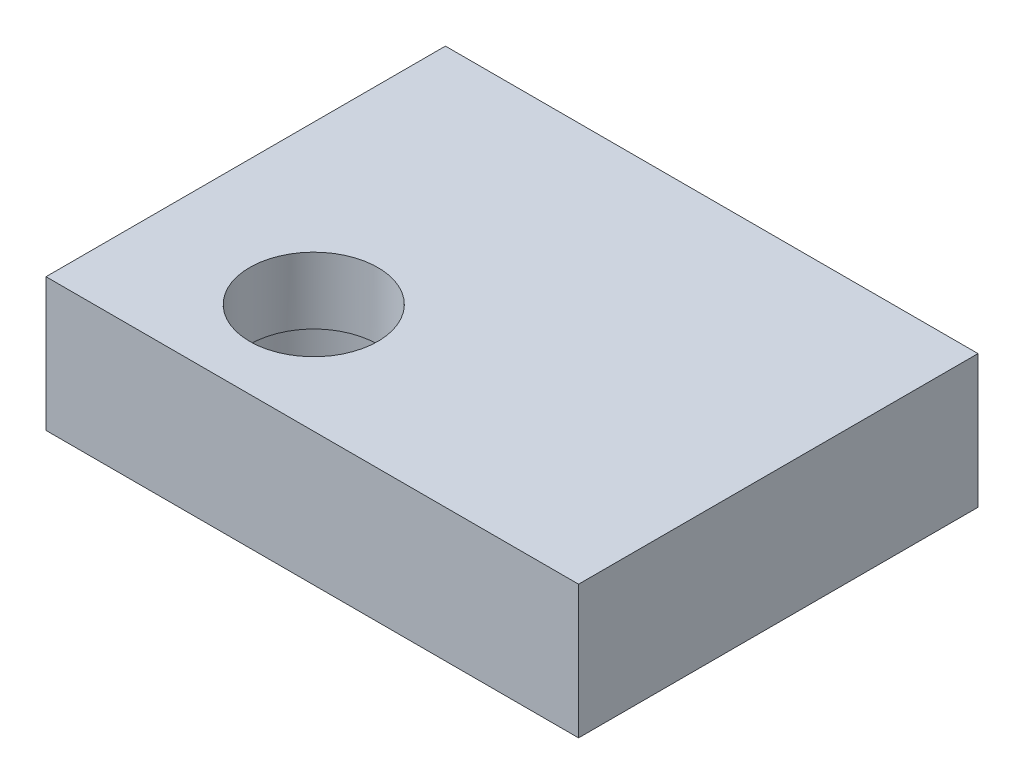
from build123d import *

# Parameters (mm, degrees)
SKETCH1_W           = 40
SKETCH1_H           = 30
BOSS_EXTRUDE1_DEPTH = 10
SKETCH2_R           = 2
SKETCH2_R_2         = 6.3
CUT_EXTRUDE1_DEPTH  = 5
SKETCH3_R           = 4.8125
CUT_EXTRUDE2_DEPTH  = 10


with BuildPart() as part:
    # Sketch1 → Boss-Extrude1 (new body)
    with BuildSketch(Plane(origin=(0, 0, 0), x_dir=(1, 0, 0), z_dir=(0, 1, 0))):
        Rectangle(SKETCH1_W, SKETCH1_H)
    extrude(amount=BOSS_EXTRUDE1_DEPTH)

    # Sketch2 → Cut-Extrude1 (cut)
    with BuildSketch(Plane(origin=(0, 0, 0), x_dir=(-1, 0, 0), z_dir=(0, -1, 0))):
        with Locations(Location((-13.333333333, -10, 0), (0, 0, 90))):
            Circle(SKETCH2_R)
        with Locations(Location((-13.333333333, 10, 0), (0, 0, 270))):
            Circle(SKETCH2_R)
        with Locations(Location((13.333333333, 10, 0), (0, 0, 90))):
            Circle(SKETCH2_R)
        with Locations(Location((8.14, -6.75, 0), (0, 0, 90))):
            Circle(SKETCH2_R_2)
    extrude(amount=-CUT_EXTRUDE1_DEPTH, mode=Mode.SUBTRACT)

    # Sketch3 → Cut-Extrude2 (cut)
    with BuildSketch(Plane(origin=(0, 10, 0), x_dir=(1, 0, 0), z_dir=(0, 1, 0))):
        with Locations(Location((-8.14, -6.75, 0), (0, 0, 270))):
            Circle(SKETCH3_R)
    extrude(amount=-CUT_EXTRUDE2_DEPTH, mode=Mode.SUBTRACT)


solid = part.part
